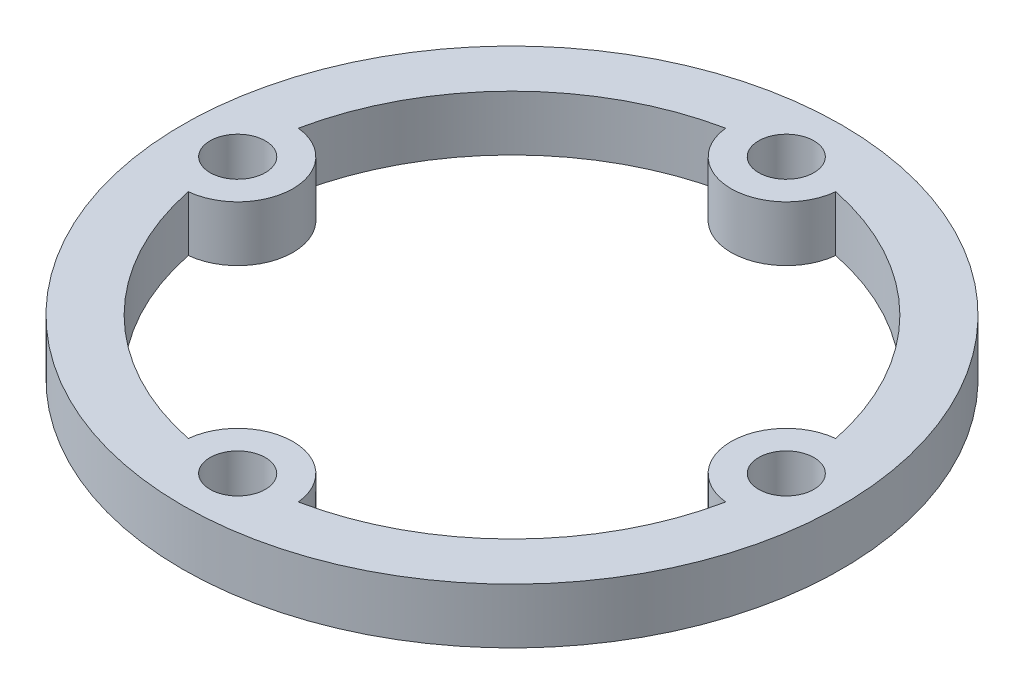
from build123d import *

# Parameters (mm, degrees)
SKETCH1_R           = 11.925
SKETCH1_R_2         = 1
BOSS_EXTRUDE1_DEPTH = 2


with BuildPart() as part:
    # Sketch1 → Boss-Extrude1 (new body)
    with BuildSketch(Plane(origin=(0, 0, 0), x_dir=(1, 0, 0), z_dir=(0, 1, 0))):
        with Locations(Location((0, 0, 0), (0, 0, 270))):
            Circle(SKETCH1_R)
        with Locations(Location((9.925, 0, 0), (0, 0, 270))):
            Circle(SKETCH1_R_2, mode=Mode.SUBTRACT)
        with BuildLine():
            ThreePointArc((-1.9898224, -9.723488665), (-7.018034803, -7.018034803), (-9.723488665, -1.9898224))
            ThreePointArc((-9.723488665, -1.9898224), (-7.925, 0), (-9.723488665, 1.9898224))
            ThreePointArc((-9.723488665, 1.9898224), (-7.018034803, 7.018034803), (-1.9898224, 9.723488665))
            ThreePointArc((-1.9898224, 9.723488665), (0, 7.925), (1.9898224, 9.723488665))
            ThreePointArc((1.9898224, 9.723488665), (7.018034803, 7.018034803), (9.723488665, 1.9898224))
            ThreePointArc((9.723488665, 1.9898224), (7.925, 0), (9.723488665, -1.9898224))
            ThreePointArc((9.723488665, -1.9898224), (7.018034803, -7.018034803), (1.9898224, -9.723488665))
            ThreePointArc((1.9898224, -9.723488665), (0, -7.925), (-1.9898224, -9.723488665))
        make_face(mode=Mode.SUBTRACT)
        with Locations(Location((-9.925, 0, 0), (0, 0, 270))):
            Circle(SKETCH1_R_2, mode=Mode.SUBTRACT)
        with Locations(Location((0, -9.925, 0), (0, 0, 270))):
            Circle(SKETCH1_R_2, mode=Mode.SUBTRACT)
        with Locations(Location((0, 9.925, 0), (0, 0, 270))):
            Circle(SKETCH1_R_2, mode=Mode.SUBTRACT)
    extrude(amount=BOSS_EXTRUDE1_DEPTH)


solid = part.part
